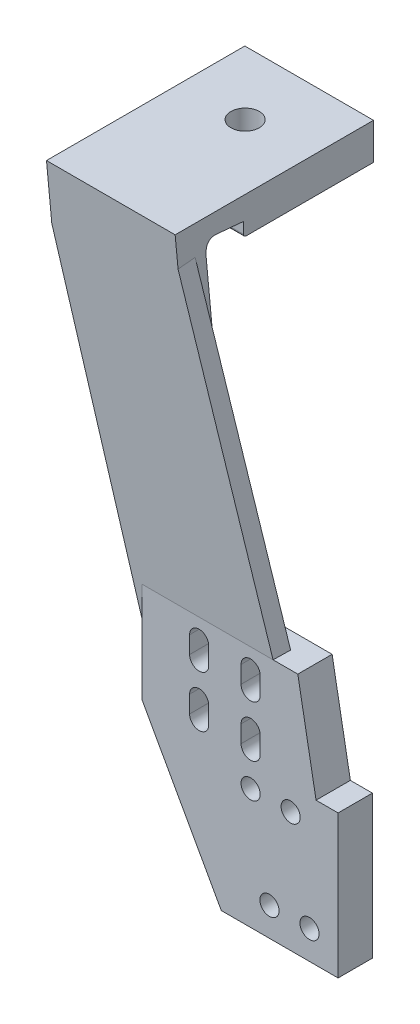
from build123d import *

# Parameters (mm, degrees)
SKETCH1_R                        = 3.35
BOSS_EXTRUDE1_DEPTH              = 12
BOSS_EXTRUDE4_DEPTH              = 23
CUT_EXTRUDE2_DEPTH               = 227.564419348
BOSS_EXTRUDE5_DEPTH              = 22
RIB8_REACH                       = 234.673
SKETCH9_WALL_W                   = 590.286406192
SKETCH9_WALL_H                   = 8
RIB13_REACH                      = 234.673
SKETCH10_WALL_W                  = 582.229830078
SKETCH10_WALL_H                  = 6
F_25_64_0_39063_DIAMETER_HOLE1_D = 9.922002


with BuildPart() as part:
    # Sketch1 → Boss-Extrude1 (new body)
    with BuildSketch(Plane.XY):
        Polygon((0, 0), (-40.842464086, 0), (-68.59, 50), (-68.59, 85), (0, 85), align=None)
        with Locations((-30.59, 42)):
            Circle(SKETCH1_R, mode=Mode.SUBTRACT)
        with Locations((-16.59, 42)):
            Circle(SKETCH1_R, mode=Mode.SUBTRACT)
        with Locations((-24, 10)):
            Circle(SKETCH1_R, mode=Mode.SUBTRACT)
        with Locations((-10, 10)):
            Circle(SKETCH1_R, mode=Mode.SUBTRACT)
        with BuildLine():
            Line((-45.24, 60), (-45.24, 54))
            ThreePointArc((-45.24, 54), (-48.59, 50.65), (-51.94, 54))
            Line((-51.94, 54), (-51.94, 60))
            ThreePointArc((-51.94, 60), (-48.59, 63.35), (-45.24, 60))
        make_face(mode=Mode.SUBTRACT)
        with BuildLine():
            Line((-45.24, 78), (-45.24, 72))
            ThreePointArc((-45.24, 72), (-48.59, 68.65), (-51.94, 72))
            Line((-51.94, 72), (-51.94, 78))
            ThreePointArc((-51.94, 78), (-48.59, 81.35), (-45.24, 78))
        make_face(mode=Mode.SUBTRACT)
        with BuildLine():
            Line((-27.24, 78), (-27.24, 72))
            ThreePointArc((-27.24, 72), (-30.59, 68.65), (-33.94, 72))
            Line((-33.94, 72), (-33.94, 78))
            ThreePointArc((-33.94, 78), (-30.59, 81.35), (-27.24, 78))
        make_face(mode=Mode.SUBTRACT)
        with BuildLine():
            Line((-27.24, 60), (-27.24, 54))
            ThreePointArc((-27.24, 54), (-30.59, 50.65), (-33.94, 54))
            Line((-33.94, 54), (-33.94, 60))
            ThreePointArc((-33.94, 60), (-30.59, 63.35), (-27.24, 60))
        make_face(mode=Mode.SUBTRACT)
    extrude(amount=BOSS_EXTRUDE1_DEPTH)

    # Sketch4 → Boss-Extrude4 (add)
    with BuildSketch(Plane.ZY.offset(68.59)):
        with BuildLine():
            Line((1.350364369, 200.289400401), (-0.475324009, 200.094696819))
            Line((-0.475324009, 200.094696819), (-0.475324009, 198.169964836))
            Line((-0.475324009, 198.169964836), (-0.475324009, 196.253602357))
            add(Edge.make_bspline(
                [(-0.475324009, 196.253602357), (-0.475324009, 196.12869199), (-0.518289538, 195.884432771), (-0.746214851, 195.524493199), (-1.106154424, 195.296567886), (-1.350413642, 195.253602357), (-1.475324009, 195.253602357)],
                knots=[0, 0, 0, 0, 0.25, 0.5, 0.75, 1, 1, 1, 1], degree=3))
            Line((-1.475324009, 195.253602357), (-45.975324009, 195.253602357))
            Line((-45.975324009, 195.253602357), (-45.975324009, 208.004109944))
            Line((-45.975324009, 208.004109944), (23.394468779, 208.004109944))
            Line((23.394468779, 208.004109944), (12, 85))
            Line((12, 85), (2.281711333, 85))
            Line((2.281711333, 85), (5.872362287, 123.761337788))
            Line((5.872362287, 123.761337788), (12.546460431, 195.808707235))
            Line((12.546460431, 195.808707235), (12.52462737, 198.022692939))
            add(Edge.make_bspline(
                [(12.52462737, 198.022692939), (12.52275101, 198.212965603), (12.485055554, 198.584771055), (12.246945435, 199.373301804), (11.607215228, 200.288314456), (10.634477398, 200.836296213), (9.82657242, 200.996816362), (9.452863838, 200.998278344), (9.263306003, 200.981694182)],
                knots=[0, 0, 0, 0, 0.125, 0.25, 0.5, 0.75, 0.875, 1, 1, 1, 1], degree=3))
            Line((9.263306003, 200.981694182), (1.350364369, 200.289400401))
        make_face()
    extrude(amount=-BOSS_EXTRUDE4_DEPTH)

    # Sketch6 → Cut-Extrude2 (cut, through all)
    with BuildSketch(Plane.XY.offset(12)):
        Polygon((-16.781583806, 99.760607563), (-7.709196228, 49.999997515), (7.428297799, 49.999995871), (-1.644090079, 99.760607563), align=None)
    extrude(amount=-CUT_EXTRUDE2_DEPTH, mode=Mode.SUBTRACT)

    # Sketch7 → Boss-Extrude5 (add)
    with BuildSketch(Plane.ZY.offset(68.59)):
        with BuildLine():
            Line((1.350364369, 200.289400401), (9.263306003, 200.981694182))
            add(Edge.make_bspline(
                [(9.263306003, 200.981694182), (9.452863838, 200.998278344), (9.82657242, 200.996816362), (10.634477398, 200.836296213), (11.607215228, 200.288314456), (12.246945435, 199.373301804), (12.485055554, 198.584771055), (12.52275101, 198.212965603), (12.52462737, 198.022692939)],
                knots=[0, 0, 0, 0, 0.125, 0.25, 0.5, 0.75, 0.875, 1, 1, 1, 1], degree=3))
            Line((12.52462737, 198.022692939), (12.546460431, 195.808707235))
            Line((12.546460431, 195.808707235), (11.914066265, 188.98196658))
            Line((11.914066265, 188.98196658), (21.549669936, 188.089373761))
            Line((21.549669936, 188.089373761), (23.394468779, 208.004109944))
            Line((23.394468779, 208.004109944), (-45.975324009, 208.004109944))
            Line((-45.975324009, 208.004109944), (-45.975324009, 195.253602357))
            Line((-45.975324009, 195.253602357), (-1.475324009, 195.253602357))
            add(Edge.make_bspline(
                [(-1.475324009, 195.253602357), (-1.350413642, 195.253602357), (-1.106154424, 195.296567886), (-0.746214851, 195.524493199), (-0.518289538, 195.884432771), (-0.475324009, 196.12869199), (-0.475324009, 196.253602357)],
                knots=[0, 0, 0, 0, 0.25, 0.5, 0.75, 1, 1, 1, 1], degree=3))
            Line((-0.475324009, 196.253602357), (-0.475324009, 200.094696819))
            Line((-0.475324009, 200.094696819), (1.350364369, 200.289400401))
        make_face()
    extrude(amount=BOSS_EXTRUDE5_DEPTH)

    # Sketch9 wall → Rib8 (add, up to next)
    with BuildSketch(Plane(origin=(-79.59, 127.869133691, 15.971176294), x_dir=(0.178948228267, -0.979664115124, -0.090751050339), z_dir=(0.983858491654, 0.178185337816, 0.016506174221)), mode=Mode.PRIVATE) as rib8_sk1:
        with Locations((0, 4)):
            Rectangle(SKETCH9_WALL_W, SKETCH9_WALL_H)
    rib8_tool1 = extrude(rib8_sk1.sketch, amount=RIB8_REACH, mode=Mode.PRIVATE) - part.part
    add(rib8_tool1.solids().sort_by_distance((-79.59, 127.869133691, 15.971176294))[0])

    # Sketch10 wall → Rib13 (add, up to next)
    with BuildSketch(Plane(origin=(-34.166372331, 141.054628888, 17.192612824), x_dir=(0.198872370592, -0.975847362421, -0.090397485977), z_dir=(0.98002539774, 0.198024539719, 0.018343975956)), mode=Mode.PRIVATE) as rib13_sk1:
        with Locations((0, 3)):
            Rectangle(SKETCH10_WALL_W, SKETCH10_WALL_H)
    rib13_tool1 = extrude(rib13_sk1.sketch, amount=-RIB13_REACH, mode=Mode.PRIVATE) - part.part
    add(rib13_tool1.solids().sort_by_distance((-34.166372331, 141.054628888, 17.192612824))[0])

    # 25/64 (0.39063) Diameter Hole1 (through all)
    with Locations(Plane(origin=(0, 208.004109944, 0), x_dir=(1, 0, 0), z_dir=(0, 1, 0))):
        with Locations((-68.242097157, 23.725324009)):
            Hole(F_25_64_0_39063_DIAMETER_HOLE1_D / 2)


solid = part.part
